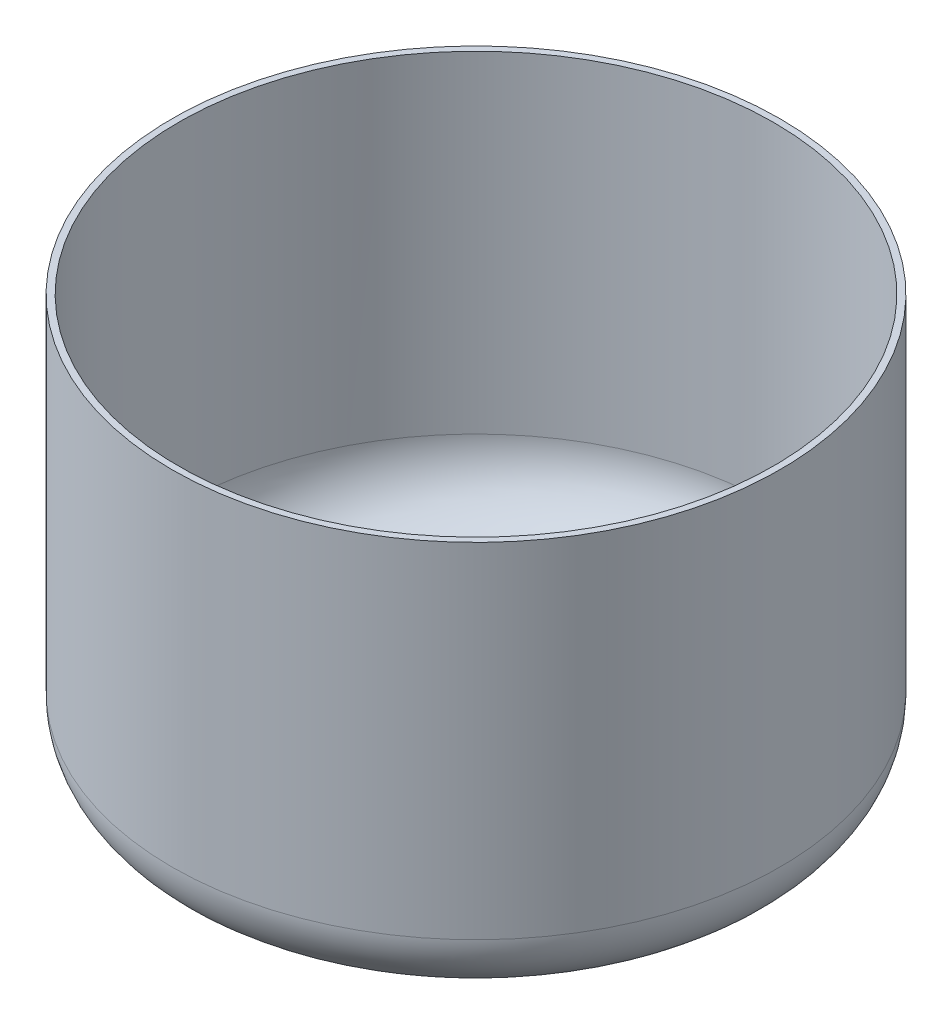
from build123d import *

# Parameters (mm, degrees)
CUT_EXTRUDE2_REACH = 237.261
MOTOR_HOLE_R       = 18.415
SKETCH1_R          = 3.25
CUT_EXTRUDE3_DEPTH = 236.261075795
FILLET2_R          = 25.4


with BuildPart() as part:
    # Compartment → Revolve1 (revolve)
    with BuildSketch(Plane.XY, mode=Mode.PRIVATE) as revolve1_sk:
        Polygon((120.65, -80), (0, -80), (0, -75), (118.11, -75), (118.11, 81.972), (120.65, 81.972), align=None)
    revolve(revolve1_sk.sketch.rotate(Axis((0, 0, 0), (0, 1, 0)), 90), axis=Axis((0, 0, 0), (0, 1, 0)))

    # Motor Hole → Cut-Extrude2 (cut, up to next)
    with BuildSketch(Plane.XZ.offset(80), mode=Mode.PRIVATE) as cut_extrude2_sk1:
        with Locations(Location((0, 0, 0), (0, 0, 270))):
            Circle(MOTOR_HOLE_R)
    cut_extrude2_tool1 = extrude(cut_extrude2_sk1.sketch, amount=-CUT_EXTRUDE2_REACH, mode=Mode.PRIVATE) & part.part
    add(cut_extrude2_tool1.solids().sort_by_distance((0, -80, 0))[0], mode=Mode.SUBTRACT)

    # Sketch1 → Cut-Extrude3 (cut, through all)
    with BuildSketch(Plane.XZ.offset(80)):
        with Locations(Location((0, 63.5, 0), (0, 0, 270))):
            Circle(SKETCH1_R)
        with Locations(Location((0, -63.5, 0), (0, 0, 270))):
            Circle(SKETCH1_R)
        with Locations(Location((63.5, 0, 0), (0, 0, 270))):
            Circle(SKETCH1_R)
        with Locations(Location((-63.5, 0, 0), (0, 0, 270))):
            Circle(SKETCH1_R)
    extrude(amount=-CUT_EXTRUDE3_DEPTH, mode=Mode.SUBTRACT)

    # Fillet2
    fillet2_edges = [part.edges().sort_by_distance(p)[0] for p in [
        (0, -75, 118.11),
        (0, -80, 120.65),
    ]]
    fillet(fillet2_edges, radius=FILLET2_R)


solid = part.part
